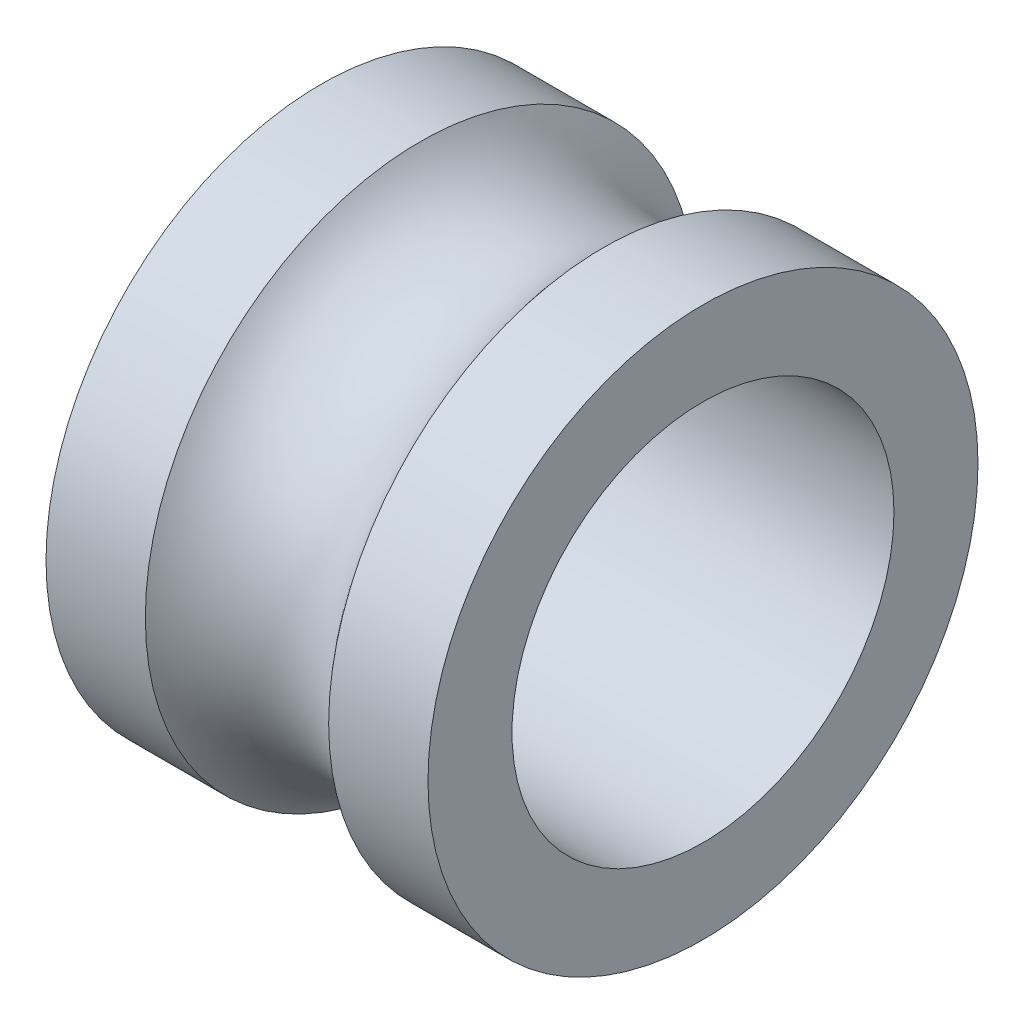
from build123d import *


with BuildPart() as part:
    # Çizim1 → Döndür1 (revolve)
    with BuildSketch(Plane.XY, mode=Mode.PRIVATE) as d_nd_r1_sk:
        with BuildLine():
            Line((2.5, 2.5), (-2.5, 2.5))
            Line((-2.5, 2.5), (-2.5, 3.6))
            Line((-2.5, 3.6), (-1.2, 3.6))
            ThreePointArc((-1.2, 3.6), (0, 3), (1.2, 3.6))
            Line((1.2, 3.6), (2.5, 3.6))
            Line((2.5, 3.6), (2.5, 2.5))
        make_face()
    revolve(d_nd_r1_sk.sketch.rotate(Axis((0, 0, 0), (-1, 0, 0)), 90), axis=Axis((0, 0, 0), (-1, 0, 0)))


solid = part.part
